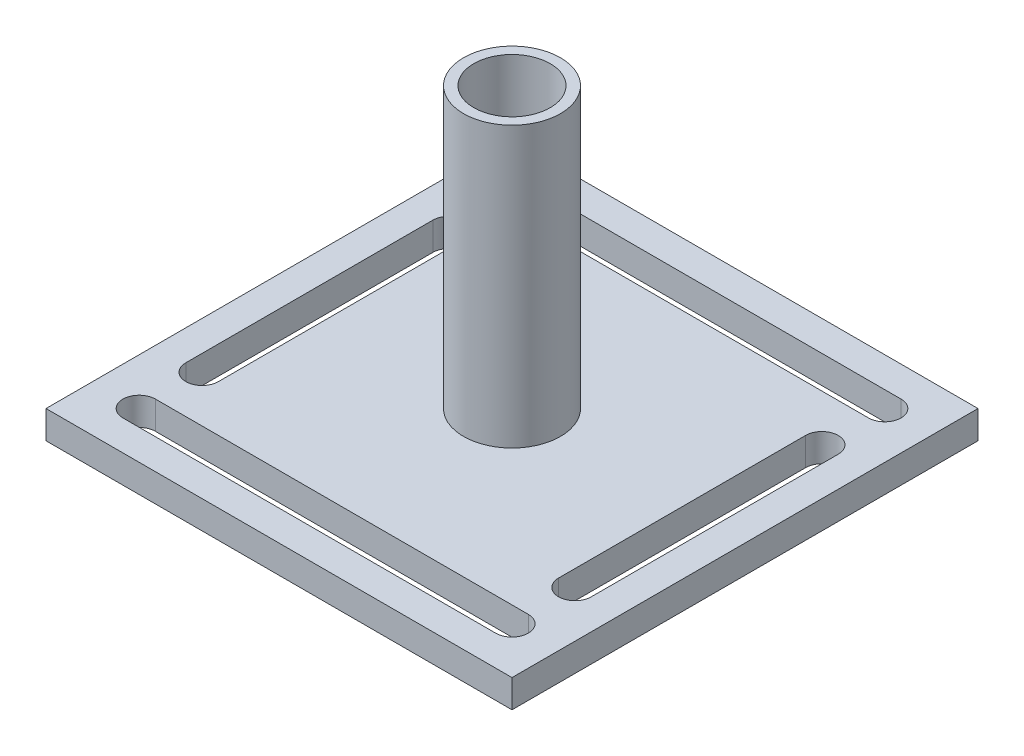
from build123d import *

# Parameters (mm, degrees)
SKETCH_1_W          = 50
SKETCH_1_H          = 50
EXTRUDE_1_DEPTH     = 3
SKETCH_2_R          = 5.2
EXTRUDE_3_DEPTH     = 30
SKETCH_4_R          = 4.1
CUT_EXTRUDE_1_DEPTH = 30
CUT_EXTRUDE_2_DEPTH = 30


with BuildPart() as part:
    # 草图1 → 凸台-拉伸1 (new body)
    with BuildSketch(Plane(origin=(0, 0, 0), x_dir=(1, 0, 0), z_dir=(0, 1, 0))):
        with Locations((25, 25)):
            Rectangle(SKETCH_1_W, SKETCH_1_H)
    extrude(amount=EXTRUDE_1_DEPTH)

    # 草图2 → 凸台-拉伸3 (add)
    with BuildSketch(Plane(origin=(0, 3, 0), x_dir=(1, 0, 0), z_dir=(0, 1, 0))):
        with Locations(Location((25, 25, 0), (0, 0, 90))):
            Circle(SKETCH_2_R)
    extrude(amount=EXTRUDE_3_DEPTH)

    # 草图4 → 切除-拉伸1 (cut)
    with BuildSketch(Plane(origin=(0, 33, 0), x_dir=(1, 0, 0), z_dir=(0, 1, 0))):
        with Locations(Location((25, 25, 0), (0, 0, 270))):
            Circle(SKETCH_4_R)
    extrude(amount=-CUT_EXTRUDE_1_DEPTH, mode=Mode.SUBTRACT)

    # 草图6 → 切除-拉伸2 (cut)
    with BuildSketch(Plane.XZ):
        with BuildLine():
            Line((5, -3.25), (45, -3.25))
            ThreePointArc((45, -3.25), (46.75, -5), (45, -6.75))
            Line((45, -6.75), (5, -6.75))
            ThreePointArc((5, -6.75), (3.25, -5), (5, -3.25))
        make_face()
        with BuildLine():
            Line((5, -46.75), (45, -46.75))
            ThreePointArc((45, -46.75), (46.75, -45), (45, -43.25))
            Line((45, -43.25), (5, -43.25))
            ThreePointArc((5, -43.25), (3.25, -45), (5, -46.75))
        make_face()
        with BuildLine():
            Line((6.75, -11.75), (6.75, -38.25))
            ThreePointArc((6.75, -38.25), (5, -40), (3.25, -38.25))
            Line((3.25, -38.25), (3.25, -11.75))
            ThreePointArc((3.25, -11.75), (5, -10), (6.75, -11.75))
        make_face()
        with BuildLine():
            Line((43.25, -11.75), (43.25, -38.25))
            ThreePointArc((43.25, -38.25), (45, -40), (46.75, -38.25))
            Line((46.75, -38.25), (46.75, -11.75))
            ThreePointArc((46.75, -11.75), (45, -10), (43.25, -11.75))
        make_face()
    extrude(amount=-CUT_EXTRUDE_2_DEPTH, mode=Mode.SUBTRACT)


solid = part.part
